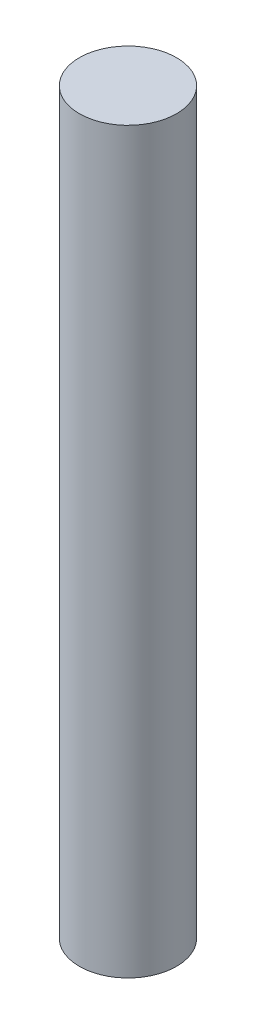
from build123d import *

# Parameters (mm, degrees)
IZIM1_R                     = 2.5
Y_KSEKLIK_EKSTR_ZYON1_DEPTH = 38


with BuildPart() as part:
    # Çizim1 → Yükseklik-Ekstrüzyon1 (new body)
    with BuildSketch(Plane(origin=(0, 0, 0), x_dir=(1, 0, 0), z_dir=(0, 1, 0))):
        with Locations(Location((0, 0, 0), (0, 0, 270))):
            Circle(IZIM1_R)
    extrude(amount=Y_KSEKLIK_EKSTR_ZYON1_DEPTH)


solid = part.part
